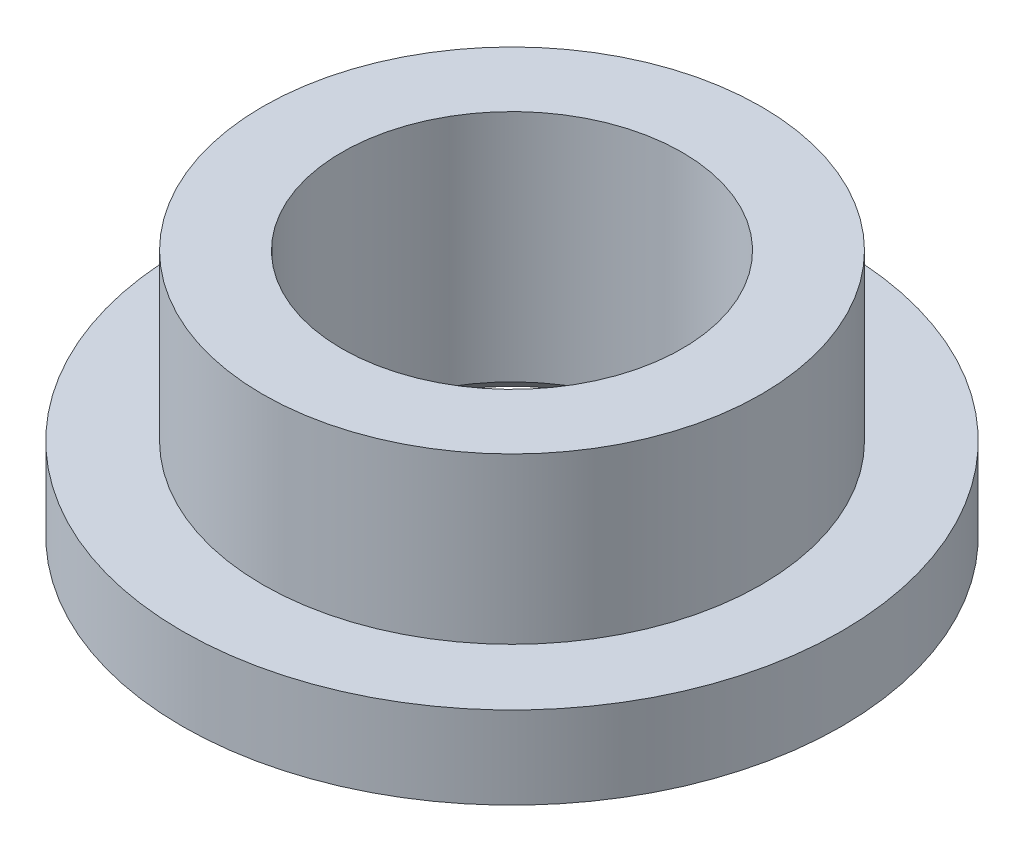
from build123d import *

# Parameters (mm, degrees)
SKETCH2_R           = 4.8006
BOSS_EXTRUDE1_DEPTH = 3.175
SKETCH3_R           = 6.35
BOSS_EXTRUDE2_DEPTH = 1.5875
SKETCH4_R           = 3.2766
CUT_EXTRUDE1_DEPTH  = 11.164959727
CHAMFER1_SIZE       = 0.254


with BuildPart() as part:
    # Sketch2 → Boss-Extrude1 (new body)
    with BuildSketch(Plane(origin=(0, 0, 0), x_dir=(1, 0, 0), z_dir=(0, 1, 0))):
        with Locations(Location((0, 0, 0), (0, 0, 270))):
            Circle(SKETCH2_R)
    extrude(amount=BOSS_EXTRUDE1_DEPTH)

    # Sketch3 → Boss-Extrude2 (add)
    with BuildSketch(Plane(origin=(0, 0, 0), x_dir=(-1, 0, 0), z_dir=(0, -1, 0))):
        with Locations(Location((0, 0, 0), (0, 0, 90))):
            Circle(SKETCH3_R)
    extrude(amount=BOSS_EXTRUDE2_DEPTH)

    # Sketch4 → Cut-Extrude1 (cut, through all)
    with BuildSketch(Plane(origin=(0, 3.175, 0), x_dir=(1, 0, 0), z_dir=(0, 1, 0))):
        with Locations(Location((0, 0, 0), (0, 0, 270))):
            Circle(SKETCH4_R)
    extrude(amount=-CUT_EXTRUDE1_DEPTH, mode=Mode.SUBTRACT)

    # Chamfer1
    chamfer1_edges = [part.edges().sort_by_distance(p)[0] for p in [
        (0, -1.5875, -3.2766),
    ]]
    chamfer(chamfer1_edges, length=CHAMFER1_SIZE)


solid = part.part
